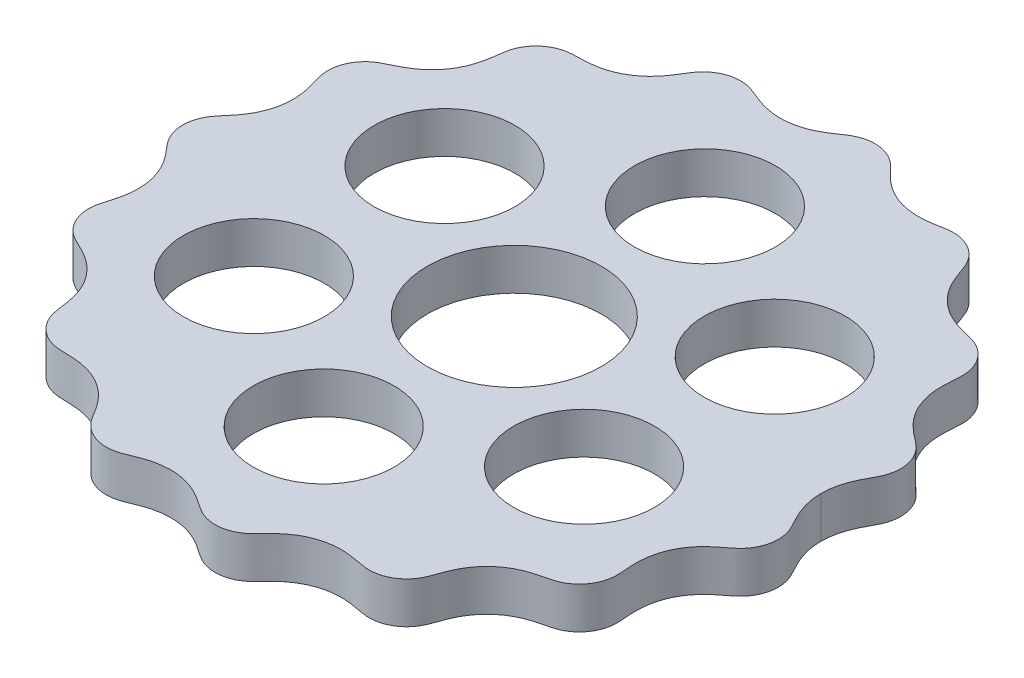
from build123d import *

# Parameters (mm, degrees)
SKETCH1_R           = 10.5
SKETCH1_R_2         = 8.5
BOSS_EXTRUDE1_DEPTH = 5


with BuildPart() as part:
    # Sketch1 → Boss-Extrude1 (new body)
    with BuildSketch(Plane(origin=(0, 0, 0), x_dir=(1, 0, 0), z_dir=(0, 1, 0))):
        with BuildLine():
            add(Edge.make_bspline(
                [(37, 0), (37, -0.03143727), (37.000453604, -0.094999987), (37.002494823, -0.209960319), (37.007935699, -0.365962041), (37.018130067, -0.547435978), (37.035778539, -0.762613663), (37.062295011, -1.000704503), (37.099596576, -1.254145629), (37.141666769, -1.490121949), (37.186730566, -1.707704996), (37.27599878, -2.086217996), (37.432607644, -2.61967024), (37.650272858, -3.191702622), (37.93344139, -3.795551093), (38.205952219, -4.315706499), (38.450459887, -4.760622269), (38.70692772, -5.235202277), (38.941768983, -5.756697541), (39.137855891, -6.378800099), (39.247955338, -7.103857197), (39.228570469, -7.939956238), (39.019285386, -8.855824089), (38.577559758, -9.823505319), (37.820964582, -10.754370621), (36.848063751, -11.434964366), (35.925475538, -12.170726431), (35.15516003, -12.931370117), (34.54379505, -13.69507461), (33.895237033, -14.741994379), (33.428420875, -15.89037885), (33.16127245, -17.104145416), (33.090755906, -18.276711653), (33.117928675, -19.134785899), (33.184630754, -19.922725011), (33.242632466, -20.644624385), (33.219628568, -21.437875666), (33.036316371, -22.28173929), (32.662226146, -23.128482681), (32.07870968, -23.926433825), (31.270520944, -24.647504284), (30.212930356, -25.195760409), (29.05618735, -25.42594367), (27.921165014, -25.714783041), (26.912865036, -26.088040866), (26.04670806, -26.526543792), (25.231490798, -27.070153578), (24.486296273, -27.716224909), (23.823206932, -28.456781999), (23.254813288, -29.28043732), (22.819009974, -30.105428972), (22.489240245, -30.904456359), (22.226168392, -31.656017359), (21.986325362, -32.344433223), (21.645702746, -33.067171886), (21.136896315, -33.772149992), (20.444596546, -34.405183962), (19.573466112, -34.908137767), (18.679093954, -35.191155104), (17.814153371, -35.279328836), (17.017950382, -35.212908103), (16.301803877, -35.076487107), (15.519474027, -34.928387551), (14.662477813, -34.814713427), (13.480415131, -34.769744423), (12.24114903, -34.919564924), (11.051981736, -35.275534421), (9.949378285, -35.820248955), (9.136432454, -36.351322247), (8.309098279, -37.037782147), (7.491403013, -37.876399022), (6.713712112, -38.763029071), (5.710099738, -39.404826423), (4.681547406, -39.744189192), (3.698738629, -39.8505626), (2.778395229, -39.751156366), (1.955929975, -39.487981912), (1.257453315, -39.111274685), (0.661270519, -38.700097997), (0.01224613, -38.248357139), (-0.717280827, -37.795796162), (-1.768012922, -37.270567489), (-2.95273679, -36.895066329), (-4.18067966, -36.725111536), (-5.411611299, -36.763370496), (-6.378691756, -36.910893684), (-7.422567546, -37.197831252), (-8.521082833, -37.628680278), (-9.596894828, -38.131330912), (-10.781414037, -38.320591212), (-11.865254321, -38.217684032), (-12.80999509, -37.9179101), (-13.765403056, -37.370059654), (-14.639711952, -36.510029041), (-15.224959633, -35.447056134), (-15.875186541, -34.432134448), (-16.722685045, -33.381987434), (-17.645169148, -32.549366783), (-18.695344863, -31.881164301), (-19.839308599, -31.403126169), (-20.793085274, -31.134677942), (-21.881721134, -30.964500418), (-23.08542905, -30.908652495), (-24.29883225, -30.933417714), (-25.48067958, -30.606197148), (-26.432898172, -30.052748184), (-27.164845045, -29.384446692), (-27.795906987, -28.497278621), (-28.22424747, -27.376816762), (-28.326856094, -26.193816744), (-28.502980453, -25.027046281), (-28.77642721, -23.979556748), (-29.132206305, -23.068277652), (-29.714540354, -21.983130932), (-30.475695851, -21.00467793), (-31.393252135, -20.166428113), (-32.373478982, -19.519081263), (-33.130172271, -19.113573457), (-33.84590289, -18.77737139), (-34.500084654, -18.466651689), (-35.175559663, -18.050104616), (-35.814710148, -17.469419425), (-36.360966849, -16.722076386), (-36.760254169, -15.817760445), (-36.980625548, -14.757313596), (-36.926633396, -13.567284636), (-36.547607451, -12.450425228), (-36.230236904, -11.323045641), (-36.049340213, -10.26320608), (-35.996011997, -9.293835891), (-36.059190915, -8.316040478), (-36.246094895, -7.347633333), (-36.555913141, -6.403126162), (-36.984986238, -5.499015409), (-37.4816085, -4.709168383), (-38.008605013, -4.023960491), (-38.528096971, -3.420524046), (-39.004092361, -2.868313104), (-39.352986229, -2.366627777), (-39.578197628, -1.930892753), (-39.717578718, -1.588781598), (-39.798314559, -1.352462415), (-39.865873622, -1.112280963), (-39.913167386, -0.89900512), (-39.945298995, -0.714032442), (-39.966442184, -0.560824818), (-39.979976403, -0.438104208), (-39.99012853, -0.31081675), (-39.99689741, -0.175935476), (-39.999435894, -0.08120679), (-40, -0.026915073), (-40, 0)],
                knots=[0.06614426, 0.06614426, 0.06614426, 0.06614426, 0.06614426, 0.067102742, 0.068061224, 0.069019706, 0.069978188, 0.071895152, 0.073812116, 0.075273751, 0.076735387, 0.078197023, 0.079658659, 0.085505202, 0.091351745, 0.094275016, 0.097198288, 0.100954467, 0.104710646, 0.108466825, 0.112223004, 0.118069589, 0.123916173, 0.130338535, 0.136760898, 0.145879075, 0.154997253, 0.161421442, 0.167845631, 0.17426982, 0.18069401, 0.193736695, 0.200258038, 0.206779381, 0.211541823, 0.216304265, 0.221066707, 0.225829148, 0.232348859, 0.238868571, 0.245245472, 0.251622373, 0.260676895, 0.269731417, 0.276109562, 0.282487707, 0.288865852, 0.295243997, 0.301811097, 0.308378198, 0.314945298, 0.321512399, 0.326307116, 0.331101834, 0.335896552, 0.340691269, 0.347256117, 0.353820965, 0.360385813, 0.366950661, 0.371745379, 0.376540096, 0.381334814, 0.386129532, 0.392696632, 0.399263733, 0.412397934, 0.418776079, 0.425154223, 0.431532368, 0.437910513, 0.446965035, 0.456019557, 0.462396459, 0.46877336, 0.475293071, 0.481812782, 0.486575224, 0.491337666, 0.496100107, 0.500862549, 0.507383892, 0.513905235, 0.526947921, 0.53337211, 0.539796299, 0.546220489, 0.552644678, 0.561762855, 0.570881032, 0.577303395, 0.583725757, 0.590229974, 0.596734191, 0.606102622, 0.615471053, 0.621977695, 0.628484337, 0.641497621, 0.648004263, 0.654510905, 0.661017547, 0.667524189, 0.67689262, 0.686261051, 0.692765268, 0.699269485, 0.705691847, 0.71211421, 0.721232387, 0.730350565, 0.736774754, 0.743198943, 0.749623132, 0.756047322, 0.769090007, 0.77561135, 0.782132693, 0.786895135, 0.791657577, 0.796420019, 0.80118246, 0.807702171, 0.814221883, 0.820598784, 0.826975685, 0.836030207, 0.845084729, 0.851462874, 0.857841019, 0.864219164, 0.870597309, 0.877164409, 0.88373151, 0.89029861, 0.896865711, 0.901660428, 0.906455146, 0.911249864, 0.916044581, 0.917685793, 0.919327005, 0.920968217, 0.922609429, 0.924250641, 0.925071247, 0.925891853, 0.926712459, 0.927533065, 0.928353671, 0.929174277, 0.929174277, 0.929174277, 0.929174277, 0.929174277], degree=4))
            add(Edge.make_bspline(
                [(-40, 0), (-40, 0.026915073), (-39.999435898, 0.081102133), (-39.996897439, 0.173969707), (-39.990128591, 0.308512197), (-39.979976315, 0.43784111), (-39.96644193, 0.561596862), (-39.949527385, 0.683811751), (-39.92923545, 0.806418669), (-39.905569953, 0.929082564), (-39.878536112, 1.05108509), (-39.840542165, 1.202393225), (-39.788245672, 1.382030281), (-39.717511124, 1.588706673), (-39.612678592, 1.8465975), (-39.4787487, 2.123083835), (-39.310663945, 2.414096923), (-39.104945299, 2.715281305), (-38.881313352, 3.003243592), (-38.647115103, 3.282501031), (-38.34984736, 3.627713203), (-37.95291863, 4.096180366), (-37.481683121, 4.709256859), (-36.984926096, 5.498908372), (-36.555971315, 6.403267497), (-36.170215472, 7.578337946), (-35.9868127, 8.798814705), (-36.009059108, 10.024440425), (-36.200622014, 11.152023378), (-36.408520549, 11.955019807), (-36.630718407, 12.680349542), (-36.821563566, 13.341696839), (-36.992348492, 14.33180594), (-36.904909082, 15.422182159), (-36.504382838, 16.524262833), (-35.814997617, 17.469697467), (-35.175412137, 18.050006312), (-34.5001255, 18.466591368), (-33.84600501, 18.777687977), (-32.905560624, 19.218134843), (-31.725163504, 19.887218348), (-30.439584969, 20.966645125), (-29.285197967, 22.586057403), (-28.686625036, 24.137217697), (-28.434119871, 25.439027518), (-28.31164158, 26.439459997), (-28.21864172, 27.126579635), (-28.036118522, 27.870890122), (-27.694662989, 28.638492196), (-27.164686183, 29.384972568), (-26.433444718, 30.052566346), (-25.634630631, 30.516068805), (-24.823088132, 30.788827784), (-24.04685872, 30.899230803), (-23.334712945, 30.920266621), (-22.306444557, 30.937751057), (-20.963494482, 31.058617768), (-19.344902311, 31.506985138), (-17.613398371, 32.506669405), (-16.415804752, 33.684227657), (-15.639656073, 34.786823183), (-15.110379913, 35.668587511), (-14.736089473, 36.274805934), (-14.252362947, 36.891838815), (-13.610375494, 37.458275746), (-12.809563546, 37.918317809), (-11.865789642, 38.217794604), (-10.954330273, 38.303527797), (-10.118839611, 38.215435923), (-9.382986221, 38.00135041), (-8.741423229, 37.738330824), (-7.813784142, 37.344183911), (-6.560131184, 36.91195486), (-4.917500499, 36.654754125), (-2.937854825, 36.844776382), (-1.360254549, 37.418406773), (-0.190612674, 38.106118753), (0.66104769, 38.700344294), (1.25752551, 39.11128049), (1.955942055, 39.487804143), (2.778297019, 39.751545742), (3.94176, 39.875855803), (5.096453052, 39.671677477), (6.084466159, 39.202219931), (6.856533473, 38.559253291), (7.333854157, 38.063319478), (7.850909823, 37.508190885), (8.442374814, 36.92670684), (9.323110596, 36.196912537), (10.58841665, 35.435636692), (11.999200644, 34.94870835), (13.48033229, 34.769799778), (14.662523081, 34.814686453), (15.519442707, 34.928402455), (16.301826743, 35.076481327), (17.01792965, 35.21290787), (17.814178726, 35.27933238), (18.679056308, 35.191146999), (19.573524947, 34.908152618), (20.444504658, 34.405159426), (21.137044029, 33.772190195), (21.591803381, 33.141505578), (21.869639533, 32.592625152), (22.075891139, 32.086193752), (22.226561366, 31.656080042), (22.376591176, 31.226097871), (22.593668003, 30.651444897), (22.86151291, 30.024879345), (23.255100485, 29.280174836), (23.822818619, 28.457094584), (24.649069231, 27.534594711), (25.802527601, 26.61516732), (27.218058872, 25.905303721), (28.817567995, 25.472660001), (30.452832349, 25.14875342), (31.698805724, 24.383263182), (32.56091801, 23.351770837), (33.037621539, 22.281751264), (33.218869869, 21.437861265), (33.242984107, 20.64464847), (33.184772246, 19.922675951), (33.096291135, 18.887971334), (33.085336205, 17.531197285), (33.377495648, 15.878125019), (34.202660288, 14.068701252), (35.246780487, 12.774733869), (36.247889348, 11.905159004), (37.053074749, 11.298868113), (37.601617193, 10.874775338), (38.154972669, 10.344538529), (38.64897071, 9.665047684), (39.030511654, 8.832802317), (39.242952499, 7.865782472), (39.245093638, 6.94215806), (39.075312522, 6.10308858), (38.783182879, 5.375443563), (38.444617083, 4.748588598), (38.126578469, 4.173031944), (37.854861766, 3.633998474), (37.633034591, 3.131674523), (37.47857496, 2.727184292), (37.362612428, 2.374730281), (37.2774171, 2.077549654), (37.216377239, 1.837879163), (37.162604445, 1.596443845), (37.116253691, 1.353582746), (37.077446812, 1.109379842), (37.050179424, 0.893728529), (37.031634183, 0.710857807), (37.019415923, 0.558351339), (37.011589025, 0.433066649), (37.00424606, 0.269586224), (37.00097986, 0.133534053), (37, 0.053352873), (37, 0)],
                knots=[0.070825729, 0.070825729, 0.070825729, 0.070825729, 0.070825729, 0.071646335, 0.072466941, 0.073287547, 0.074108153, 0.074928759, 0.075749365, 0.076569971, 0.077390577, 0.078211183, 0.079031789, 0.080673002, 0.082314214, 0.083955426, 0.086352785, 0.088750144, 0.091147503, 0.093544862, 0.095942221, 0.09833958, 0.103134298, 0.109701399, 0.1162685, 0.122835601, 0.129402703, 0.142158993, 0.148537139, 0.154915284, 0.159442546, 0.163969807, 0.168497068, 0.17302433, 0.185778133, 0.192297845, 0.198817557, 0.203579999, 0.208342441, 0.213104883, 0.217867326, 0.230910013, 0.243952699, 0.256801079, 0.269649459, 0.274208548, 0.278767637, 0.283326726, 0.287885815, 0.294308178, 0.300730541, 0.307234758, 0.313738976, 0.318423192, 0.323107408, 0.327791624, 0.33247584, 0.345489125, 0.35850241, 0.371515695, 0.38452898, 0.389213196, 0.393897412, 0.398581628, 0.403265844, 0.409770061, 0.416274278, 0.422696641, 0.429119005, 0.433678094, 0.438237183, 0.442796272, 0.447355361, 0.46020374, 0.47305212, 0.486094807, 0.499137494, 0.503899936, 0.508662378, 0.51342482, 0.518187263, 0.524706974, 0.531226686, 0.54398049, 0.548507751, 0.553035012, 0.557562274, 0.562089535, 0.568467681, 0.574845826, 0.587602117, 0.600736319, 0.60730342, 0.613870521, 0.618665239, 0.623459957, 0.628254676, 0.633049394, 0.639614242, 0.64617909, 0.652743939, 0.659308787, 0.664103505, 0.666500865, 0.668898224, 0.673692942, 0.676090301, 0.67848766, 0.685054761, 0.691621862, 0.698188963, 0.704756064, 0.717512355, 0.730268646, 0.739323169, 0.748377691, 0.761131495, 0.767651207, 0.774170918, 0.778933361, 0.783695803, 0.788458245, 0.793220687, 0.806263374, 0.819306061, 0.832154441, 0.84500282, 0.849561909, 0.854120998, 0.858680087, 0.863239176, 0.869661539, 0.876083903, 0.88258812, 0.889092337, 0.893776553, 0.898460769, 0.903144985, 0.907829201, 0.911082522, 0.914335844, 0.917589165, 0.919215826, 0.920842486, 0.922469147, 0.924095807, 0.925722468, 0.927349129, 0.928975789, 0.92978912, 0.93060245, 0.93141578, 0.932229111, 0.933855771, 0.933855771, 0.933855771, 0.933855771, 0.933855771], degree=4))
        make_face()
        with Locations(Location((0, 0, 0), (0, 0, 270))):
            Circle(SKETCH1_R, mode=Mode.SUBTRACT)
        with Locations(Location((0, 23, 0), (0, 0, 270))):
            Circle(SKETCH1_R_2, mode=Mode.SUBTRACT)
        with Locations(Location((19.918584287, 11.5, 0), (0, 0, 270))):
            Circle(SKETCH1_R_2, mode=Mode.SUBTRACT)
        with Locations(Location((19.918584287, -11.5, 0), (0, 0, 270))):
            Circle(SKETCH1_R_2, mode=Mode.SUBTRACT)
        with Locations(Location((0, -23, 0), (0, 0, 270))):
            Circle(SKETCH1_R_2, mode=Mode.SUBTRACT)
        with Locations(Location((-19.918584287, -11.5, 0), (0, 0, 270))):
            Circle(SKETCH1_R_2, mode=Mode.SUBTRACT)
        with Locations(Location((-19.918584287, 11.5, 0), (0, 0, 270))):
            Circle(SKETCH1_R_2, mode=Mode.SUBTRACT)
    extrude(amount=BOSS_EXTRUDE1_DEPTH)


solid = part.part
